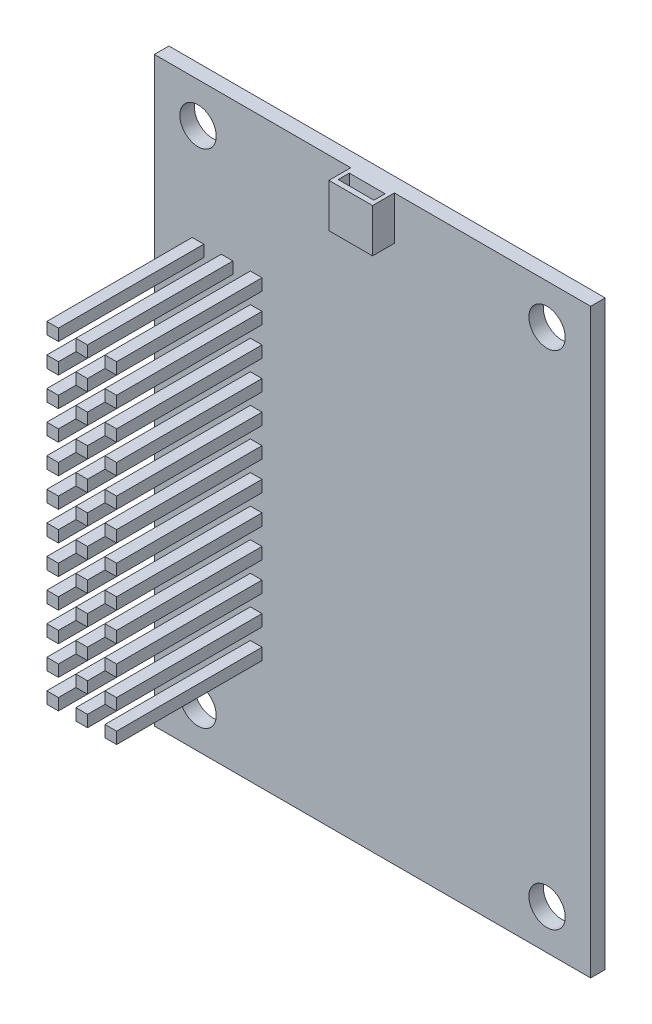
from build123d import *

# Parameters (mm, degrees)
SKETCH_1_W          = 30
SKETCH_1_H          = 40
SKETCH_1_R          = 1.25
EXTRUDE_1_DEPTH     = 1
SKETCH_2_W          = 0.8
SKETCH_2_H          = 0.8
EXTRUDE_2_DEPTH     = 10
SKETCH_3_W          = 3
SKETCH_3_H          = 1.5
EXTRUDE_3_DEPTH     = 3
SKETCH_4_W          = 2.462162708
SKETCH_4_H          = 0.766502898
CUT_EXTRUDE_1_DEPTH = 1.5


with BuildPart() as part:
    # 草图1 → 凸台-拉伸1 (new body)
    with BuildSketch(Plane.XY):
        Rectangle(SKETCH_1_W, SKETCH_1_H)
        with Locations((-12, 17.25)):
            Circle(SKETCH_1_R, mode=Mode.SUBTRACT)
        with Locations((12, 17.25)):
            Circle(SKETCH_1_R, mode=Mode.SUBTRACT)
        with Locations((12, -17.25)):
            Circle(SKETCH_1_R, mode=Mode.SUBTRACT)
        with Locations((-12, -17.25)):
            Circle(SKETCH_1_R, mode=Mode.SUBTRACT)
    extrude(amount=EXTRUDE_1_DEPTH)

    # 草图2 → 凸台-拉伸2 (add)
    with BuildSketch(Plane.XY.offset(1)):
        with Locations((-12, -10)):
            Rectangle(SKETCH_2_W, SKETCH_2_H)
        with Locations((-12, -12)):
            Rectangle(SKETCH_2_W, SKETCH_2_H)
        with Locations((-12, -8)):
            Rectangle(SKETCH_2_W, SKETCH_2_H)
        with Locations((-12, -6)):
            Rectangle(SKETCH_2_W, SKETCH_2_H)
        with Locations((-12, -4)):
            Rectangle(SKETCH_2_W, SKETCH_2_H)
        with Locations((-12, -2)):
            Rectangle(SKETCH_2_W, SKETCH_2_H)
        with Locations((-12, 0)):
            Rectangle(SKETCH_2_W, SKETCH_2_H)
        with Locations((-12, 2)):
            Rectangle(SKETCH_2_W, SKETCH_2_H)
        with Locations((-12, 4)):
            Rectangle(SKETCH_2_W, SKETCH_2_H)
        with Locations((-12, 6)):
            Rectangle(SKETCH_2_W, SKETCH_2_H)
        with Locations((-12, 8)):
            Rectangle(SKETCH_2_W, SKETCH_2_H)
        with Locations((-12, 10)):
            Rectangle(SKETCH_2_W, SKETCH_2_H)
        with Locations((-10, -10)):
            Rectangle(SKETCH_2_W, SKETCH_2_H)
        with Locations((-10, -12)):
            Rectangle(SKETCH_2_W, SKETCH_2_H)
        with Locations((-10, -8)):
            Rectangle(SKETCH_2_W, SKETCH_2_H)
        with Locations((-10, -6)):
            Rectangle(SKETCH_2_W, SKETCH_2_H)
        with Locations((-10, -4)):
            Rectangle(SKETCH_2_W, SKETCH_2_H)
        with Locations((-10, -2)):
            Rectangle(SKETCH_2_W, SKETCH_2_H)
        with Locations((-10, 0)):
            Rectangle(SKETCH_2_W, SKETCH_2_H)
        with Locations((-10, 2)):
            Rectangle(SKETCH_2_W, SKETCH_2_H)
        with Locations((-10, 4)):
            Rectangle(SKETCH_2_W, SKETCH_2_H)
        with Locations((-10, 6)):
            Rectangle(SKETCH_2_W, SKETCH_2_H)
        with Locations((-10, 8)):
            Rectangle(SKETCH_2_W, SKETCH_2_H)
        with Locations((-10, 10)):
            Rectangle(SKETCH_2_W, SKETCH_2_H)
        with Locations((-8, -10)):
            Rectangle(SKETCH_2_W, SKETCH_2_H)
        with Locations((-8, -12)):
            Rectangle(SKETCH_2_W, SKETCH_2_H)
        with Locations((-8, -8)):
            Rectangle(SKETCH_2_W, SKETCH_2_H)
        with Locations((-8, -6)):
            Rectangle(SKETCH_2_W, SKETCH_2_H)
        with Locations((-8, -4)):
            Rectangle(SKETCH_2_W, SKETCH_2_H)
        with Locations((-8, -2)):
            Rectangle(SKETCH_2_W, SKETCH_2_H)
        with Locations((-8, 0)):
            Rectangle(SKETCH_2_W, SKETCH_2_H)
        with Locations((-8, 2)):
            Rectangle(SKETCH_2_W, SKETCH_2_H)
        with Locations((-8, 4)):
            Rectangle(SKETCH_2_W, SKETCH_2_H)
        with Locations((-8, 6)):
            Rectangle(SKETCH_2_W, SKETCH_2_H)
        with Locations((-8, 8)):
            Rectangle(SKETCH_2_W, SKETCH_2_H)
        with Locations((-8, 10)):
            Rectangle(SKETCH_2_W, SKETCH_2_H)
    extrude(amount=EXTRUDE_2_DEPTH)

    # 草图3 → 凸台-拉伸3 (add)
    with BuildSketch(Plane(origin=(0, 20, 0), x_dir=(1, 0, 0), z_dir=(0, 1, 0))):
        with Locations((0, -1.75)):
            Rectangle(SKETCH_3_W, SKETCH_3_H)
    extrude(amount=-EXTRUDE_3_DEPTH)

    # 草图4 → 切除-拉伸1 (cut)
    with BuildSketch(Plane(origin=(0, 20, 0), x_dir=(1, 0, 0), z_dir=(0, 1, 0))):
        with Locations((0, -1.75)):
            Rectangle(SKETCH_4_W, SKETCH_4_H)
    extrude(amount=-CUT_EXTRUDE_1_DEPTH, mode=Mode.SUBTRACT)


solid = part.part
